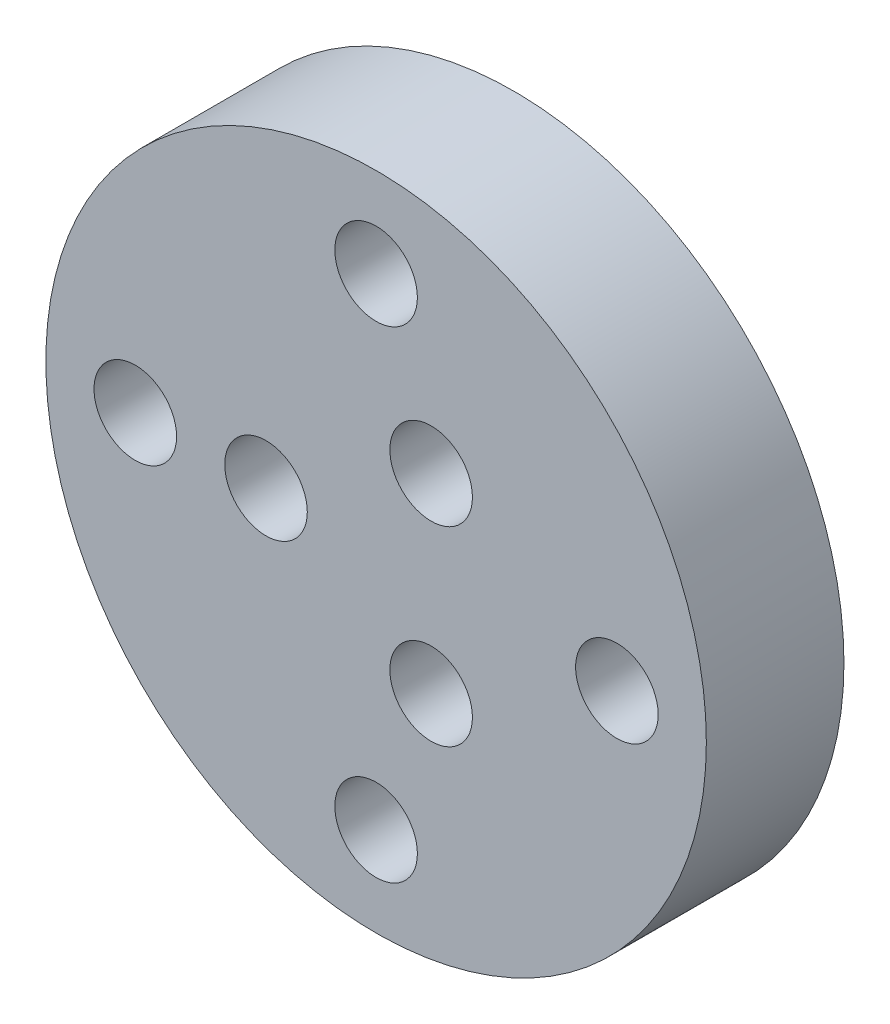
from build123d import *

# Parameters (mm, degrees)
SKETCH_1_R      = 24
SKETCH_1_R_2    = 3
EXTRUDE_1_DEPTH = 10


with BuildPart() as part:
    # 草图1 → 凸台-拉伸1 (new body)
    with BuildSketch(Plane.XY):
        Circle(SKETCH_1_R)
        with Locations((-8, 0)):
            Circle(SKETCH_1_R_2, mode=Mode.SUBTRACT)
        with Locations((4, 6.92820323)):
            Circle(SKETCH_1_R_2, mode=Mode.SUBTRACT)
        with Locations((4, -6.92820323)):
            Circle(SKETCH_1_R_2, mode=Mode.SUBTRACT)
        with Locations((-17.5, 0)):
            Circle(SKETCH_1_R_2, mode=Mode.SUBTRACT)
        with Locations((0, 17.5)):
            Circle(SKETCH_1_R_2, mode=Mode.SUBTRACT)
        with Locations((17.5, 0)):
            Circle(SKETCH_1_R_2, mode=Mode.SUBTRACT)
        with Locations((0, -17.5)):
            Circle(SKETCH_1_R_2, mode=Mode.SUBTRACT)
    extrude(amount=EXTRUDE_1_DEPTH)


solid = part.part
